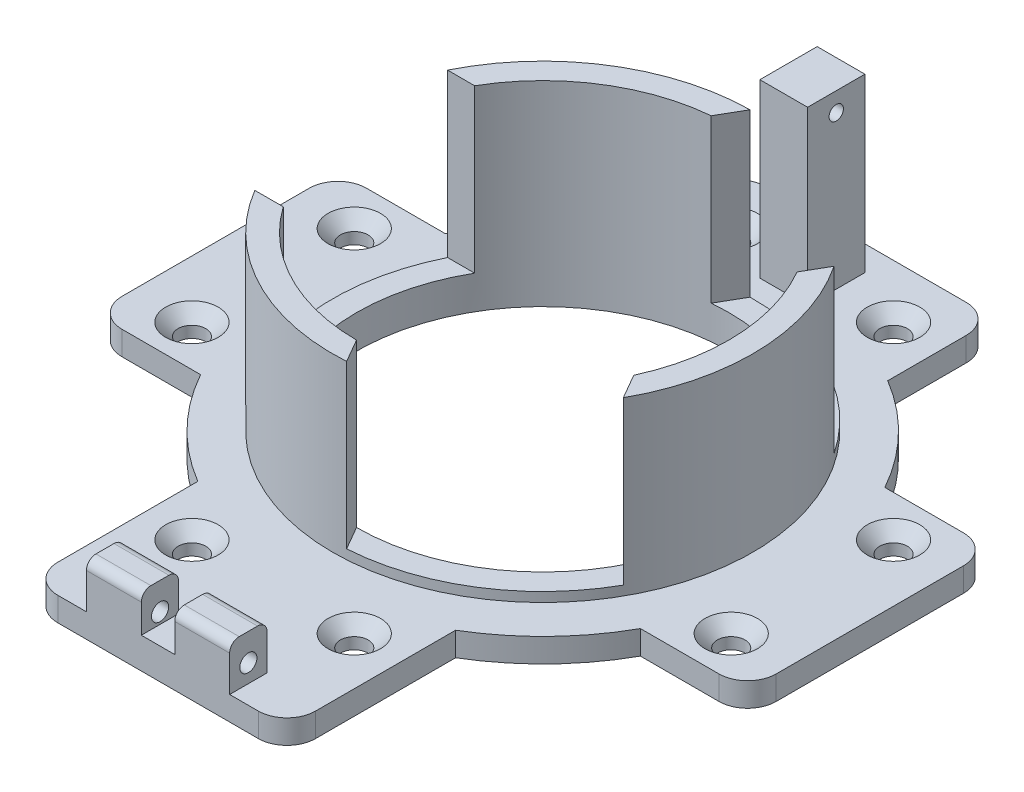
from build123d import *

# Parameters (mm, degrees)
BOSS_EXTRUDE3_DEPTH                          = 2.5
SKETCH1_6_R                                  = 22
SKETCH1_6_R_2                                = 19.5
BOSS_EXTRUDE4_DEPTH                          = 20.5
CUT_EXTRUDE2_REACH                           = 58.717
SKETCH33_W                                   = 21
SKETCH33_H                                   = 17
CIRPATTERN1_COUNT                            = 3
SKETCH1_7_R                                  = 19.5
CUT_EXTRUDE1_DEPTH                           = 18
CSK_FOR_M2_5_COUNTERSUNK_FLAT_HEAD_S_2_COUNT = 2
CSK_FOR_M2_5_COUNTERSUNK_FLAT_HEAD_S_2_PITCH = 17
CSK_FOR_M2_5_COUNTERSUNK_FLAT_HEAD_S_3_COUNT = 2
CSK_FOR_M2_5_COUNTERSUNK_FLAT_HEAD_S_3_PITCH = 41.706591715
CSK_FOR_M2_5_COUNTERSUNK_FLAT_HEAD_S_4_COUNT = 2
CSK_FOR_M2_5_COUNTERSUNK_FLAT_HEAD_S_4_PITCH = 51.957512596
CSK_FOR_M2_5_COUNTERSUNK_FLAT_HEAD_S_5_COUNT = 2
CSK_FOR_M2_5_COUNTERSUNK_FLAT_HEAD_S_5_PITCH = 58.982027644
CSK_FOR_M2_5_COUNTERSUNK_FLAT_HEAD_S_6_COUNT = 2
CSK_FOR_M2_5_COUNTERSUNK_FLAT_HEAD_S_6_PITCH = 56.47901898
CSK_FOR_M2_5_COUNTERSUNK_FLAT_HEAD_S_7_COUNT = 2
CSK_FOR_M2_5_COUNTERSUNK_FLAT_HEAD_S_7_PITCH = 27.915882035
CSK_FOR_M2_5_COUNTERSUNK_FLAT_HEAD_S_8_COUNT = 2
CSK_FOR_M2_5_COUNTERSUNK_FLAT_HEAD_S_8_PITCH = 41.706591715
SKETCH15_W                                   = 5.75
SKETCH15_H                                   = 3.887074911
SKETCH15_H_2                                 = 3.91851851
BOSS_EXTRUDE5_DEPTH                          = 4.75
SKETCH16_W                                   = 3.5
SKETCH16_H                                   = 7
BOSS_EXTRUDE6_DEPTH                          = 0.75
FILLET1_R                                    = 3
FILLET2_R                                    = 3
FILLET3_R                                    = 3
FILLET4_R                                    = 3
FILLET5_R                                    = 3
FILLET6_R                                    = 3
FILLET7_R                                    = 3
FILLET8_R                                    = 3
FILLET9_R                                    = 1
FILLET10_R                                   = 1
FILLET11_R                                   = 1
FILLET12_R                                   = 1
F_1_8_1_8_DIAMETER_HOLE2_D                   = 1.8
SKETCH22_W                                   = 5
SKETCH22_H                                   = 6
BOSS_EXTRUDE7_DEPTH                          = 18
F_1_5_1_5_DIAMETER_HOLE1_D                   = 1.5


with BuildPart() as part:
    # Sketch1 → Boss-Extrude3 (new body)
    with BuildSketch(Plane(origin=(0, 0, 0), x_dir=(1, 0, 0), z_dir=(0, 1, 0))):
        with BuildLine():
            Line((-34.253186733, 12.8), (-23.032205713, 12.8))
            ThreePointArc((-23.032205713, 12.8), (-18.915679134, 18.344470091), (-13.5, 22.62901898))
            Line((-13.5, 22.62901898), (-13.5, 33.85))
            Line((-13.5, 33.85), (13.5, 33.85))
            Line((13.5, 33.85), (13.5, 22.62901898))
            ThreePointArc((13.5, 22.62901898), (18.915679134, 18.344470091), (23.032205713, 12.8))
            Line((23.032205713, 12.8), (34.253186733, 12.8))
            Line((34.253186733, 12.8), (34.253186733, -12.8))
            Line((34.253186733, -12.8), (23.032205713, -12.8))
            ThreePointArc((23.032205713, -12.8), (18.915679134, -18.344470091), (13.5, -22.62901898))
            Line((13.5, -22.62901898), (13.5, -40.29))
            Line((13.5, -40.29), (-13.5, -40.29))
            Line((-13.5, -40.29), (-13.5, -22.62901898))
            ThreePointArc((-13.5, -22.62901898), (-18.915679134, -18.344470091), (-23.032205713, -12.8))
            Line((-23.032205713, -12.8), (-34.253186733, -12.8))
            Line((-34.253186733, -12.8), (-34.253186733, 12.8))
        make_face()
    extrude(amount=BOSS_EXTRUDE3_DEPTH)

    # Sketch1<6> → Boss-Extrude4 (add)
    with BuildSketch(Plane(origin=(0, 0, 0), x_dir=(1, 0, 0), z_dir=(0, 1, 0))):
        Circle(SKETCH1_6_R)
        Circle(SKETCH1_6_R_2, mode=Mode.SUBTRACT)
    extrude(amount=BOSS_EXTRUDE4_DEPTH)

    # Sketch33 → Cut-Extrude2 (cut, up to next)
    with BuildSketch(Plane(origin=(0, 0, 0), x_dir=(0, 0, -1), z_dir=(1, 0, 0)), mode=Mode.PRIVATE) as cut_extrude2_sk1:
        with Locations((-0.746304841, 12)):
            Rectangle(SKETCH33_W, SKETCH33_H)
    cut_extrude2_tool1 = extrude(cut_extrude2_sk1.sketch, amount=-CUT_EXTRUDE2_REACH, mode=Mode.PRIVATE) & part.part
    cut_extrude2 = cut_extrude2_tool1.solids().sort_by_distance((0, 12, 0.746305))[0]
    add(cut_extrude2, mode=Mode.SUBTRACT)

    # CirPattern1: Cut-Extrude2 ×3 about axis
    cirpattern1_axis = Axis((0, 20.5, 0), (0, 1, 0))
    for i in range(1, CIRPATTERN1_COUNT):
        add(cut_extrude2.rotate(cirpattern1_axis, i * 360 / CIRPATTERN1_COUNT), mode=Mode.SUBTRACT)

    # Sketch1<7> → Cut-Extrude1 (cut)
    with BuildSketch(Plane(origin=(0, 0, 0), x_dir=(1, 0, 0), z_dir=(0, 1, 0))):
        Circle(SKETCH1_7_R)
    extrude(amount=CUT_EXTRUDE1_DEPTH, mode=Mode.SUBTRACT)

    # Sketch14 → CSK for M2.5 Countersunk Flat Head Screw1 (revolve, cut)
    with BuildSketch(Plane(origin=(-8.5, 2.5, -28.23950949), x_dir=(0, 0, 1), z_dir=(1, 0, 0))):
        Polygon((0, 0), (0, 2.5), (1.45, 2.5), (1.45, 1.3), (2.75, 0), align=None)
    csk_for_m2_5_countersunk_flat_head_screw = revolve(axis=Axis((-8.5, 8.85, -28.23950949), (0, -1, 0)), mode=Mode.SUBTRACT)

    # CSK for M2.5 Countersunk Flat Head S 2: CSK for M2.5 Countersunk Flat Head Screw1 ×2
    with Locations(*[(i * CSK_FOR_M2_5_COUNTERSUNK_FLAT_HEAD_S_2_PITCH, 0, 0) for i in range(1, CSK_FOR_M2_5_COUNTERSUNK_FLAT_HEAD_S_2_COUNT)]):
        add(csk_for_m2_5_countersunk_flat_head_screw, mode=Mode.SUBTRACT)

    # CSK for M2.5 Countersunk Flat Head S 3: CSK for M2.5 Countersunk Flat Head Screw1 ×2
    with Locations(*[Vector(0.8809041443894198, 0, 0.4732947162155356) * (i * CSK_FOR_M2_5_COUNTERSUNK_FLAT_HEAD_S_3_PITCH) for i in range(1, CSK_FOR_M2_5_COUNTERSUNK_FLAT_HEAD_S_3_COUNT)]):
        add(csk_for_m2_5_countersunk_flat_head_screw, mode=Mode.SUBTRACT)

    # CSK for M2.5 Countersunk Flat Head S 4: CSK for M2.5 Countersunk Flat Head Screw1 ×2
    with Locations(*[Vector(0.7071067811865471, 0, 0.7071067811865479) * (i * CSK_FOR_M2_5_COUNTERSUNK_FLAT_HEAD_S_4_PITCH) for i in range(1, CSK_FOR_M2_5_COUNTERSUNK_FLAT_HEAD_S_4_COUNT)]):
        add(csk_for_m2_5_countersunk_flat_head_screw, mode=Mode.SUBTRACT)

    # CSK for M2.5 Countersunk Flat Head S 5: CSK for M2.5 Countersunk Flat Head Screw1 ×2
    with Locations(*[Vector(0.28822339073732456, 0, 0.9575631974088601) * (i * CSK_FOR_M2_5_COUNTERSUNK_FLAT_HEAD_S_5_PITCH) for i in range(1, CSK_FOR_M2_5_COUNTERSUNK_FLAT_HEAD_S_5_COUNT)]):
        add(csk_for_m2_5_countersunk_flat_head_screw, mode=Mode.SUBTRACT)

    # CSK for M2.5 Countersunk Flat Head S 6: CSK for M2.5 Countersunk Flat Head Screw1 ×2
    with Locations(*[(0, 0, i * CSK_FOR_M2_5_COUNTERSUNK_FLAT_HEAD_S_6_PITCH) for i in range(1, CSK_FOR_M2_5_COUNTERSUNK_FLAT_HEAD_S_6_COUNT)]):
        add(csk_for_m2_5_countersunk_flat_head_screw, mode=Mode.SUBTRACT)

    # CSK for M2.5 Countersunk Flat Head S 7: CSK for M2.5 Countersunk Flat Head Screw1 ×2
    with Locations(*[Vector(-0.7071067811865482, 0, 0.7071067811865469) * (i * CSK_FOR_M2_5_COUNTERSUNK_FLAT_HEAD_S_7_PITCH) for i in range(1, CSK_FOR_M2_5_COUNTERSUNK_FLAT_HEAD_S_7_COUNT)]):
        add(csk_for_m2_5_countersunk_flat_head_screw, mode=Mode.SUBTRACT)

    # CSK for M2.5 Countersunk Flat Head S 8: CSK for M2.5 Countersunk Flat Head Screw1 ×2
    with Locations(*[Vector(-0.4732947162155356, 0, 0.8809041443894198) * (i * CSK_FOR_M2_5_COUNTERSUNK_FLAT_HEAD_S_8_PITCH) for i in range(1, CSK_FOR_M2_5_COUNTERSUNK_FLAT_HEAD_S_8_COUNT)]):
        add(csk_for_m2_5_countersunk_flat_head_screw, mode=Mode.SUBTRACT)

    # Sketch15 → Boss-Extrude5 (add)
    with BuildSketch(Plane(origin=(0, 2.5, 0), x_dir=(1, 0, 0), z_dir=(0, 1, 0))):
        with Locations((-4.625, -38.346462544)):
            Rectangle(SKETCH15_W, SKETCH15_H)
        with Locations((4.625, -38.330740745)):
            Rectangle(SKETCH15_W, SKETCH15_H_2)
    extrude(amount=BOSS_EXTRUDE5_DEPTH)

    # Sketch16 → Boss-Extrude6 (add)
    with BuildSketch(Plane(origin=(0, 2.5, 0), x_dir=(1, 0, 0), z_dir=(0, 1, 0))):
        with Locations((0, -36.79)):
            Rectangle(SKETCH16_W, SKETCH16_H)
    extrude(amount=BOSS_EXTRUDE6_DEPTH)

    # Fillet1
    fillet1_edges = [part.edges().sort_by_distance(p)[0] for p in [
        (34.253186733, 1.25, 12.8),
    ]]
    fillet(fillet1_edges, radius=FILLET1_R)

    # Fillet2
    fillet2_edges = [part.edges().sort_by_distance(p)[0] for p in [
        (34.253186733, 1.25, -12.8),
    ]]
    fillet(fillet2_edges, radius=FILLET2_R)

    # Fillet3
    fillet3_edges = [part.edges().sort_by_distance(p)[0] for p in [
        (13.5, 1.25, -33.85),
    ]]
    fillet(fillet3_edges, radius=FILLET3_R)

    # Fillet4
    fillet4_edges = [part.edges().sort_by_distance(p)[0] for p in [
        (-13.5, 1.25, -33.85),
    ]]
    fillet(fillet4_edges, radius=FILLET4_R)

    # Fillet5
    fillet5_edges = [part.edges().sort_by_distance(p)[0] for p in [
        (-34.253186733, 1.25, -12.8),
    ]]
    fillet(fillet5_edges, radius=FILLET5_R)

    # Fillet6
    fillet6_edges = [part.edges().sort_by_distance(p)[0] for p in [
        (-34.253186733, 1.25, 12.8),
    ]]
    fillet(fillet6_edges, radius=FILLET6_R)

    # Fillet7
    fillet7_edges = [part.edges().sort_by_distance(p)[0] for p in [
        (-13.5, 1.25, 40.29),
    ]]
    fillet(fillet7_edges, radius=FILLET7_R)

    # Fillet8
    fillet8_edges = [part.edges().sort_by_distance(p)[0] for p in [
        (13.5, 1.25, 40.29),
    ]]
    fillet(fillet8_edges, radius=FILLET8_R)

    # Fillet9
    fillet9_edges = [part.edges().sort_by_distance(p)[0] for p in [
        (-4.625, 7.25, 36.402925089),
    ]]
    fillet(fillet9_edges, radius=FILLET9_R)

    # Fillet10
    fillet10_edges = [part.edges().sort_by_distance(p)[0] for p in [
        (-4.625, 7.25, 40.29),
    ]]
    fillet(fillet10_edges, radius=FILLET10_R)

    # Fillet11
    fillet11_edges = [part.edges().sort_by_distance(p)[0] for p in [
        (4.625, 7.25, 40.29),
    ]]
    fillet(fillet11_edges, radius=FILLET11_R)

    # Fillet12
    fillet12_edges = [part.edges().sort_by_distance(p)[0] for p in [
        (4.625, 7.25, 36.37148149),
    ]]
    fillet(fillet12_edges, radius=FILLET12_R)

    # Ø1.8 (1.8) Diameter Hole2 (through all)
    with Locations(Plane(origin=(7.5, 0, 0), x_dir=(0, 0, -1), z_dir=(1, 0, 0))):
        with Locations((-38.330740745, 4.4)):
            Hole(F_1_8_1_8_DIAMETER_HOLE2_D / 2)

    # Sketch22 → Boss-Extrude7 (add)
    with BuildSketch(Plane(origin=(0, 2.5, 0), x_dir=(1, 0, 0), z_dir=(0, 1, 0))):
        with Locations((0, 28.23950949)):
            Rectangle(SKETCH22_W, SKETCH22_H)
    extrude(amount=BOSS_EXTRUDE7_DEPTH)

    # Ø1.5 (1.5) Diameter Hole1 (through all)
    with Locations(Plane.ZY.offset(2.5)):
        with Locations((-28.23950949, 18.5)):
            Hole(F_1_5_1_5_DIAMETER_HOLE1_D / 2)


solid = part.part
